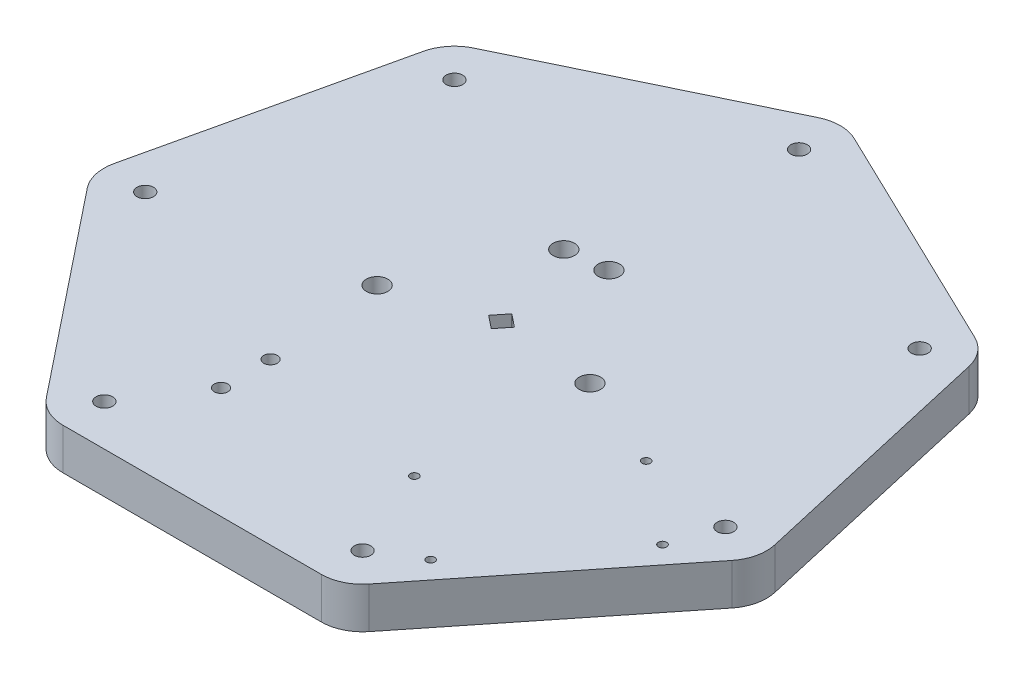
from build123d import *

# Parameters (mm, degrees)
SKETCH1_R           = 2
SKETCH1_R_2         = 1.65
SKETCH1_R_3         = 2.6
SKETCH1_R_4         = 1
BOSS_EXTRUDE1_DEPTH = 10


with BuildPart() as part:
    # Sketch1 → Boss-Extrude1 (new body)
    with BuildSketch(Plane(origin=(0, 0, 0), x_dir=(1, 0, 0), z_dir=(0, 1, 0))):
        with BuildLine():
            Line((80.08502162, -13.828464902), (66.154165207, 47.206604996))
            ThreePointArc((66.154165207, 47.206604996), (64.22320091, 51.216293675), (60.743723476, 53.991084335))
            Line((60.743723476, 53.991084335), (4.338837391, 81.15424585))
            ThreePointArc((4.338837391, 81.15424585), (0, 82.144557171), (-4.338837391, 81.15424585))
            Line((-4.338837391, 81.15424585), (-60.743723476, 53.991084335))
            ThreePointArc((-60.743723476, 53.991084335), (-64.22320091, 51.216293675), (-66.154165207, 47.206604996))
            Line((-66.154165207, 47.206604996), (-80.08502162, -13.828464902))
            ThreePointArc((-80.08502162, -13.828464902), (-80.08502162, -18.278883581), (-78.154057323, -22.28857226))
            Line((-78.154057323, -22.28857226), (-39.120665047, -71.234898019))
            ThreePointArc((-39.120665047, -71.234898019), (-35.641187614, -74.009688679), (-31.302350222, -75))
            Line((-31.302350222, -75), (31.302350222, -75))
            ThreePointArc((31.302350222, -75), (35.641187614, -74.009688679), (39.120665047, -71.234898019))
            Line((39.120665047, -71.234898019), (78.154057323, -22.28857226))
            ThreePointArc((78.154057323, -22.28857226), (80.08502162, -18.278883581), (80.08502162, -13.828464902))
        make_face()
        with Locations(Location((-31.302350222, -65, 0), (0, 0, 270))):
            Circle(SKETCH1_R, mode=Mode.SUBTRACT)
        with Locations(Location((70.335742498, -16.053674242, 0), (0, 0, 270))):
            Circle(SKETCH1_R, mode=Mode.SUBTRACT)
        with Locations(Location((0, 72.144557171, 0), (0, 0, 270))):
            Circle(SKETCH1_R, mode=Mode.SUBTRACT)
        with Locations(Location((56.404886085, 44.981395656, 0), (0, 0, 270))):
            Circle(SKETCH1_R, mode=Mode.SUBTRACT)
        with Locations(Location((-56.404886085, 44.981395656, 0), (0, 0, 270))):
            Circle(SKETCH1_R, mode=Mode.SUBTRACT)
        with Locations(Location((-70.335742498, -16.053674242, 0), (0, 0, 270))):
            Circle(SKETCH1_R, mode=Mode.SUBTRACT)
        with Locations(Location((31.302350222, -65, 0), (0, 0, 270))):
            Circle(SKETCH1_R, mode=Mode.SUBTRACT)
        with Locations(Location((-20, -48, 0), (0, 0, 270))):
            Circle(SKETCH1_R_2, mode=Mode.SUBTRACT)
        with Locations(Location((-20, -36, 0), (0, 0, 270))):
            Circle(SKETCH1_R_2, mode=Mode.SUBTRACT)
        with Locations(Location((-22.633605309, -7.531262225, 0), (0, 0, 270))):
            Circle(SKETCH1_R_3, mode=Mode.SUBTRACT)
        with Locations(Location((2.305986765, 23.741997074, 0), (0, 0, 270))):
            Circle(SKETCH1_R_3, mode=Mode.SUBTRACT)
        with Locations(Location((-7.531262225, 22.633605309, 0), (0, 0, 270))):
            Circle(SKETCH1_R_3, mode=Mode.SUBTRACT)
        with Locations(Location((23.741997074, -2.305986765, 0), (0, 0, 270))):
            Circle(SKETCH1_R_3, mode=Mode.SUBTRACT)
        with Locations(Location((41.476576253, -58.657425978, 0), (0, 0, 270))):
            Circle(SKETCH1_R_4, mode=Mode.SUBTRACT)
        with Locations(Location((66.416168327, -27.384166679, 0), (0, 0, 270))):
            Circle(SKETCH1_R_4, mode=Mode.SUBTRACT)
        with Locations(Location((46.870381266, -11.796921632, 0), (0, 0, 270))):
            Circle(SKETCH1_R_4, mode=Mode.SUBTRACT)
        with Locations(Location((21.930789191, -43.070180931, 0), (0, 0, 270))):
            Circle(SKETCH1_R_4, mode=Mode.SUBTRACT)
        Polygon((0.316683361, -2.810642569), (2.810642569, 0.316683361), (-0.316683361, 2.810642569), (-2.810642569, -0.316683361), align=None, mode=Mode.SUBTRACT)
    extrude(amount=BOSS_EXTRUDE1_DEPTH)


solid = part.part
